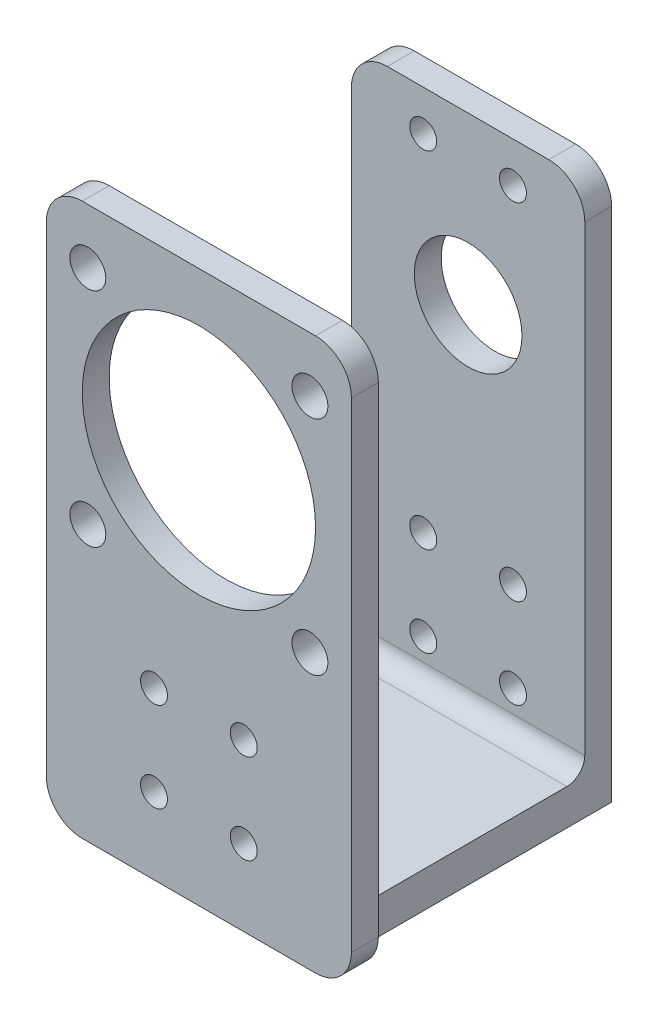
from build123d import *

# Parameters (mm, degrees)
SKETCH_1_W          = 26
SKETCH_1_H          = 57.5
SKETCH_1_R          = 1.5
SKETCH_1_R_2        = 6
EXTRUDE_1_DEPTH     = 3
SKETCH_2_W          = 26
SKETCH_2_H          = 3
EXTRUDE_2_DEPTH     = 33
SKETCH_3_W          = 34
SKETCH_3_H          = 60.5
SKETCH_3_R          = 2
SKETCH_3_R_2        = 13
EXTRUDE_3_DEPTH     = 3
FILLET_1_R          = 2
EXTRUDE_4_DEPTH     = 1
FILLET_2_R          = 4
SKETCH_5_R          = 1.5
CUT_EXTRUDE_1_DEPTH = 50.503156465


with BuildPart() as part:
    # 草图1 → 凸台-拉伸1 (new body)
    with BuildSketch(Plane.XY):
        Rectangle(SKETCH_1_W, SKETCH_1_H)
        with Locations((-5, 24.25)):
            Circle(SKETCH_1_R, mode=Mode.SUBTRACT)
        with Locations((5, 24.25)):
            Circle(SKETCH_1_R, mode=Mode.SUBTRACT)
        with Locations((5, -24.25)):
            Circle(SKETCH_1_R, mode=Mode.SUBTRACT)
        with Locations((-5, -24.25)):
            Circle(SKETCH_1_R, mode=Mode.SUBTRACT)
        with Locations((0, 10.25)):
            Circle(SKETCH_1_R_2, mode=Mode.SUBTRACT)
    extrude(amount=EXTRUDE_1_DEPTH)

    # 草图2 → 凸台-拉伸2 (add)
    with BuildSketch(Plane(origin=(0, 0, 0), x_dir=(-1, 0, 0), z_dir=(0, 0, -1))):
        with Locations((0, -30.25)):
            Rectangle(SKETCH_2_W, SKETCH_2_H)
    extrude(amount=-EXTRUDE_2_DEPTH)

    # 草图3 → 凸台-拉伸3 (add)
    with BuildSketch(Plane.XY.offset(33)):
        with Locations((0, -1.5)):
            Rectangle(SKETCH_3_W, SKETCH_3_H)
        with Locations((12.374368671, 22.624368671)):
            Circle(SKETCH_3_R, mode=Mode.SUBTRACT)
        with Locations((12.374368671, -2.124368671)):
            Circle(SKETCH_3_R, mode=Mode.SUBTRACT)
        with Locations((-12.374368671, -2.124368671)):
            Circle(SKETCH_3_R, mode=Mode.SUBTRACT)
        with Locations((-12.374368671, 22.624368671)):
            Circle(SKETCH_3_R, mode=Mode.SUBTRACT)
        with Locations((0, 10.25)):
            Circle(SKETCH_3_R_2, mode=Mode.SUBTRACT)
    extrude(amount=-EXTRUDE_3_DEPTH)

    # 圆角1
    fillet_1_edges = [part.edges().sort_by_distance(p)[0] for p in [
        (0, -28.75, 3),
        (0, -28.75, 30),
    ]]
    fillet(fillet_1_edges, radius=FILLET_1_R)

    # 草图4 → 凸台-拉伸4 (add)
    with BuildSketch(Plane.XZ.offset(31.75)):
        Polygon((13, 0), (13, 30), (17, 30), (17, 33), (-17, 33), (-17, 30), (-13, 30), (-13, 0), align=None)
    extrude(amount=EXTRUDE_4_DEPTH)

    # 圆角2
    fillet_2_edges = [part.edges().sort_by_distance(p)[0] for p in [
        (-13, 28.75, 1.5),
        (13, 28.75, 1.5),
        (-17, 28.75, 31.5),
        (17, 28.75, 31.5),
        (17, -32.75, 31.5),
        (-17, -32.75, 31.5),
    ]]
    fillet(fillet_2_edges, radius=FILLET_2_R)

    # 草图5 → 切除-拉伸1 (cut, through all)
    with BuildSketch(Plane(origin=(0, 0, 0), x_dir=(-1, 0, 0), z_dir=(0, 0, -1))):
        with Locations(Location((-5, -24.25, 0), (0, 0, 180))):
            Circle(SKETCH_5_R)
        with Locations(Location((5, -24.25, 0), (0, 0, 180))):
            Circle(SKETCH_5_R)
        with Locations((-5, -14.244897428)):
            Circle(SKETCH_5_R)
        with Locations((5, -14.244897428)):
            Circle(SKETCH_5_R)
    extrude(amount=-CUT_EXTRUDE_1_DEPTH, mode=Mode.SUBTRACT)


solid = part.part
